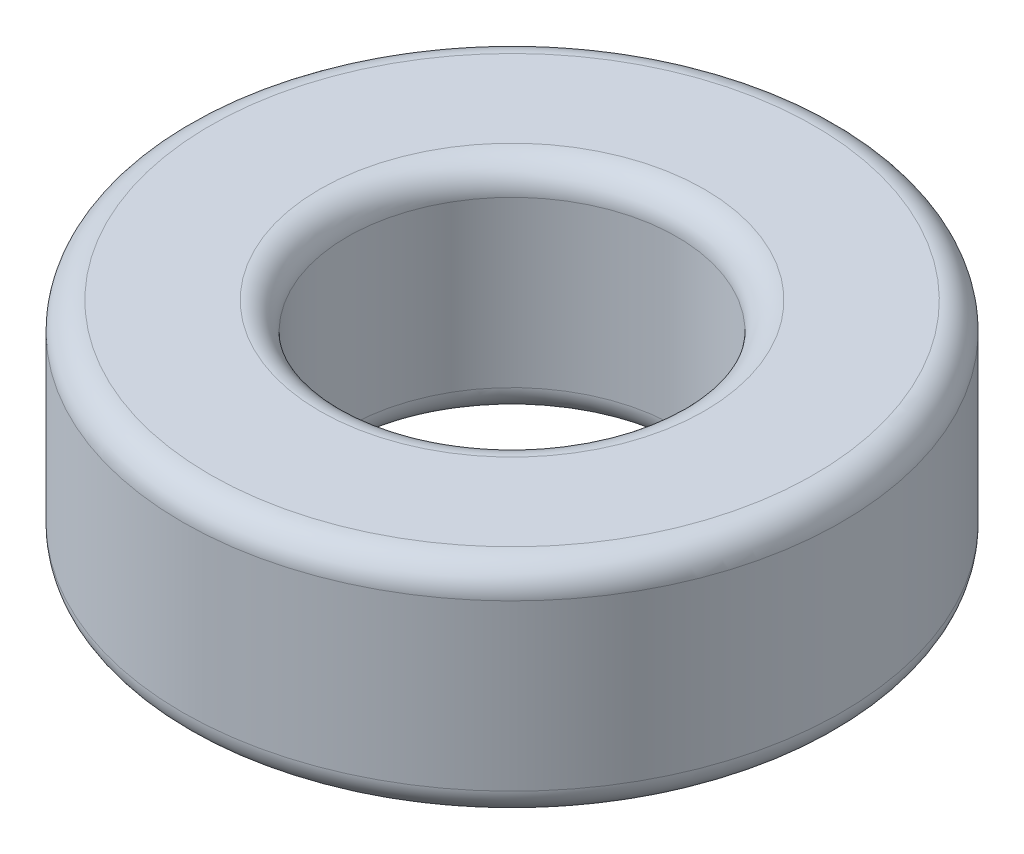
from build123d import *

# Parameters (mm, degrees)
SKETCH_1_R      = 6
SKETCH_1_R_2    = 3
EXTRUDE_1_DEPTH = 4
FILLET_1_R      = 0.5


with BuildPart() as part:
    # 草图1 → 凸台-拉伸1 (new body)
    with BuildSketch(Plane(origin=(0, 0, 0), x_dir=(1, 0, 0), z_dir=(0, 1, 0))):
        with Locations(Location((0, 0, 0), (0, 0, 270))):
            Circle(SKETCH_1_R)
        with Locations(Location((0, 0, 0), (0, 0, 270))):
            Circle(SKETCH_1_R_2, mode=Mode.SUBTRACT)
    extrude(amount=EXTRUDE_1_DEPTH)

    # 圆角1
    fillet_1_edges = [part.edges().sort_by_distance(p)[0] for p in [
        (0, 0, -6),
        (0, 4, -6),
        (0, 0, -3),
        (0, 4, -3),
    ]]
    fillet(fillet_1_edges, radius=FILLET_1_R)


solid = part.part
